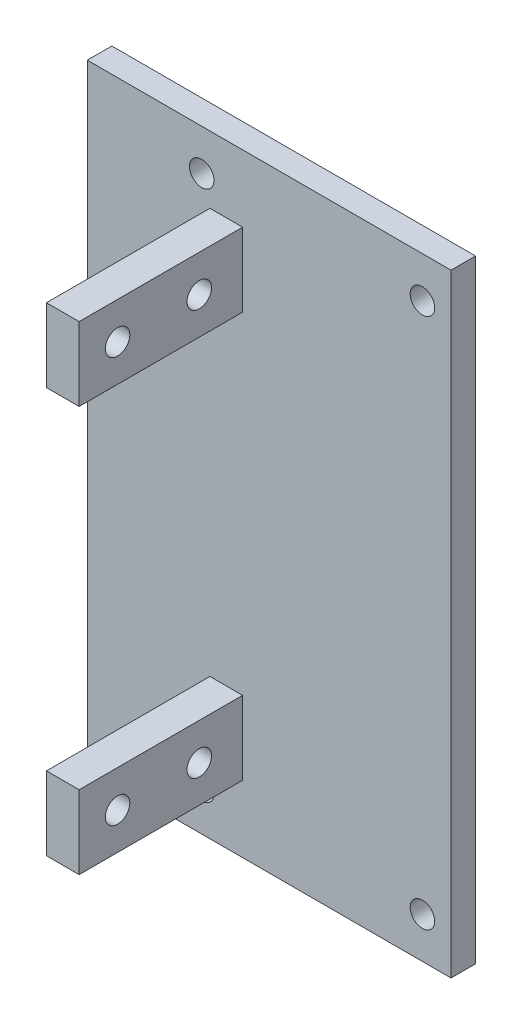
from build123d import *

# Parameters (mm, degrees)
SKETCH1_W           = 50
SKETCH1_H           = 75
SKETCH1_R           = 1.5
BOSS_EXTRUDE1_DEPTH = 3
SKETCH2_W           = 4
SKETCH2_H           = 9
BOSS_EXTRUDE2_DEPTH = 20
SKETCH3_R           = 1.5
CUT_EXTRUDE2_DEPTH  = 57.216100896
SKETCH4_W           = 5.5
SKETCH4_H           = 75
CUT_EXTRUDE3_DEPTH  = 10


with BuildPart() as part:
    # Sketch1 → Boss-Extrude1 (new body)
    with BuildSketch(Plane.XY):
        Rectangle(SKETCH1_W, SKETCH1_H)
        with Locations((-11, 32.5)):
            Circle(SKETCH1_R, mode=Mode.SUBTRACT)
        with Locations((16, 32.5)):
            Circle(SKETCH1_R, mode=Mode.SUBTRACT)
        with Locations((16, -32.5)):
            Circle(SKETCH1_R, mode=Mode.SUBTRACT)
        with Locations((-11, -32.5)):
            Circle(SKETCH1_R, mode=Mode.SUBTRACT)
    extrude(amount=BOSS_EXTRUDE1_DEPTH)

    # Sketch2 → Boss-Extrude2 (add)
    with BuildSketch(Plane.XY.offset(3)):
        with Locations((-8, 24.8)):
            Rectangle(SKETCH2_W, SKETCH2_H)
    boss_extrude2 = extrude(amount=BOSS_EXTRUDE2_DEPTH)

    # Sketch3 → Cut-Extrude2 (cut, symmetric)
    with BuildSketch(Plane.ZY.offset(10)):
        with Locations((18.3, 24.8)):
            Circle(SKETCH3_R)
        with Locations((8.3, 24.8)):
            Circle(SKETCH3_R)
    cut_extrude2 = extrude(amount=CUT_EXTRUDE2_DEPTH, both=True, mode=Mode.SUBTRACT)

    # Mirror3: Boss-Extrude2, Cut-Extrude2 across plane
    add(boss_extrude2.mirror(Plane.ZX))
    add(cut_extrude2.mirror(Plane.ZX), mode=Mode.SUBTRACT)

    # Sketch4 → Cut-Extrude3 (cut)
    with BuildSketch(Plane.XY.offset(3)):
        with Locations((22.25, 0)):
            Rectangle(SKETCH4_W, SKETCH4_H)
    extrude(amount=-CUT_EXTRUDE3_DEPTH, mode=Mode.SUBTRACT)


solid = part.part
